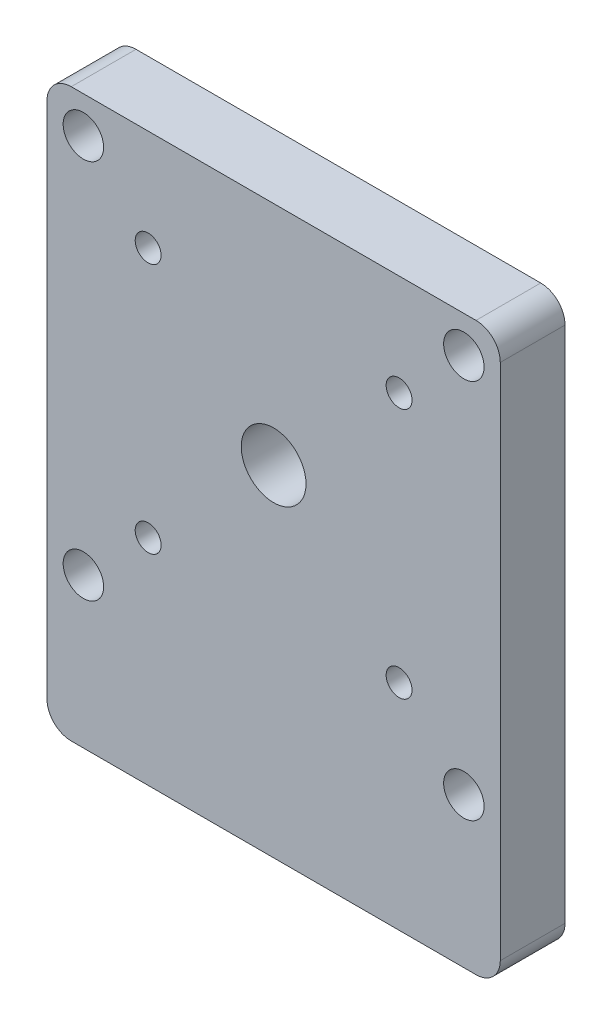
from build123d import *

# Parameters (mm, degrees)
SKETCH1_W           = 56
SKETCH1_H           = 70
BOSS_EXTRUDE1_DEPTH = 4
SKETCH2_R           = 2.5
SKETCH2_R_2         = 4
SKETCH2_R_3         = 1.6
CUT_EXTRUDE1_DEPTH  = 46.530209751
FILLET1_R           = 3


with BuildPart() as part:
    # Sketch1 → Boss-Extrude1 (new, symmetric)
    with BuildSketch(Plane.XY):
        Rectangle(SKETCH1_W, SKETCH1_H)
    extrude(amount=BOSS_EXTRUDE1_DEPTH, both=True)

    # Sketch2 → Cut-Extrude1 (cut, through all)
    with BuildSketch(Plane.XY.offset(4)):
        with Locations((-23.5, 30.5)):
            Circle(SKETCH2_R)
        with Locations((23.5, 30.5)):
            Circle(SKETCH2_R)
        with Locations((23.5, -16.5)):
            Circle(SKETCH2_R)
        with Locations((-23.5, -16.5)):
            Circle(SKETCH2_R)
        with Locations((0, 7)):
            Circle(SKETCH2_R_2)
        with Locations((-15.5, 22.5)):
            Circle(SKETCH2_R_3)
        with Locations((15.5, 22.5)):
            Circle(SKETCH2_R_3)
        with Locations((15.5, -8.5)):
            Circle(SKETCH2_R_3)
        with Locations((-15.5, -8.5)):
            Circle(SKETCH2_R_3)
    extrude(amount=-CUT_EXTRUDE1_DEPTH, mode=Mode.SUBTRACT)

    # Fillet1
    fillet1_edges = [part.edges().sort_by_distance(p)[0] for p in [
        (28, -35, 0),
        (-28, -35, 0),
        (-28, 35, 0),
        (28, 35, 0),
    ]]
    fillet(fillet1_edges, radius=FILLET1_R)


solid = part.part
